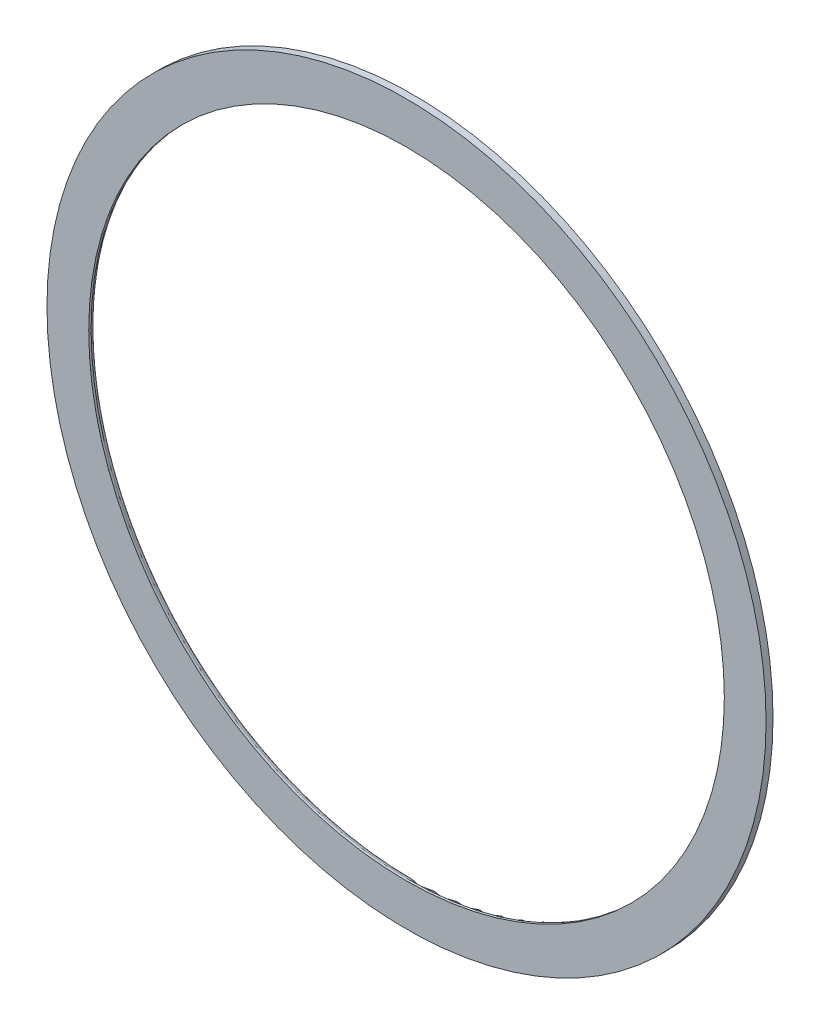
from build123d import *

# Parameters (mm, degrees)
SKETCH_1_R      = 77.5
SKETCH_1_R_2    = 68.5
EXTRUDE_1_DEPTH = 1.5
FILLET_1_R      = 1


with BuildPart() as part:
    # 草图1 → 拉伸-薄壁1 (new body)
    with BuildSketch(Plane.XY):
        Circle(SKETCH_1_R)
        Circle(SKETCH_1_R_2, mode=Mode.SUBTRACT)
    extrude(amount=EXTRUDE_1_DEPTH)

    # 圆角1
    fillet_1_edges = [part.edges().sort_by_distance(p)[0] for p in [
        (-68.5, 0, 0),
    ]]
    fillet(fillet_1_edges, radius=FILLET_1_R)


solid = part.part
